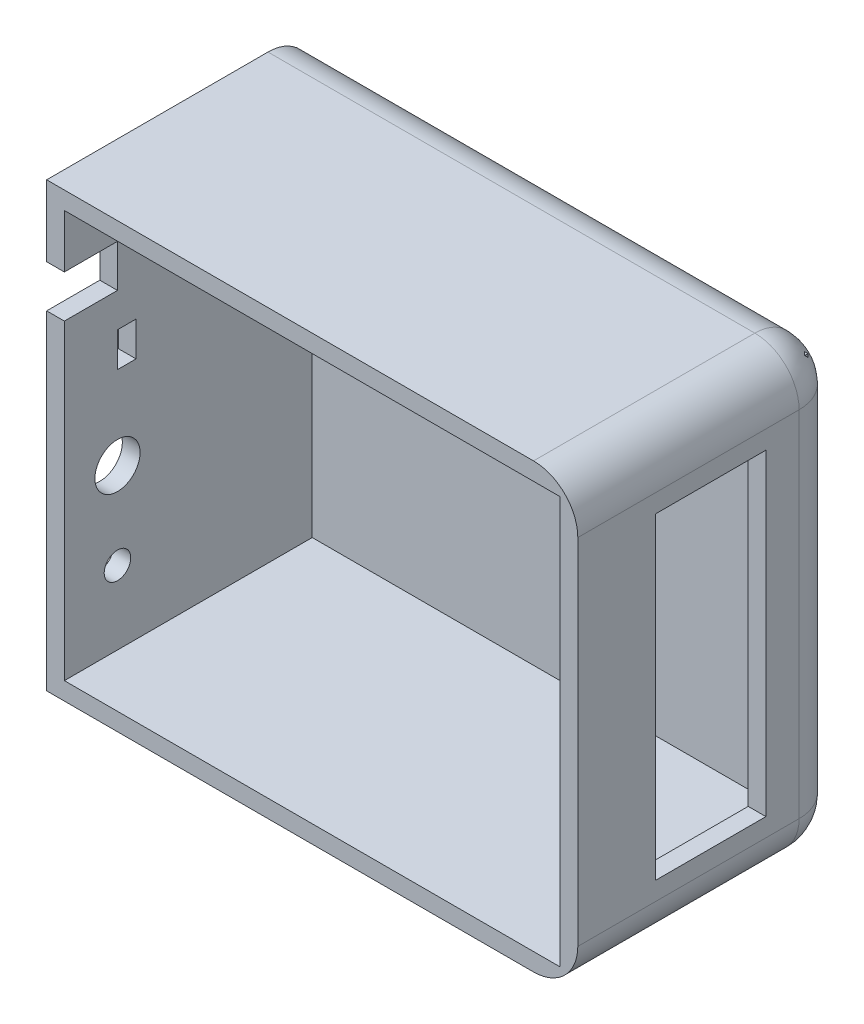
from build123d import *

# Parameters (mm, degrees)
ESBO_O1_W                  = 120
ESBO_O1_H                  = 100
RESSALTO_EXTRUS_O1_DEPTH   = 4
ESBO_O2_W                  = 4
ESBO_O2_H                  = 4
ESBO_O2_W_2                = 112
ESBO_O2_H_2                = 92
RESSALTO_EXTRUS_O2_DEPTH   = 60
CORTE_EXTRUS_O1_DEPTH      = 26
CORTE_EXTRUS_O1_DEPTH_BACK = 23
FILETE1_R                  = 10
FILETE2_R                  = 10
FILETE3_R                  = 10
CORTE_EXTRUS_O2_DEPTH      = 37
CORTE_EXTRUS_O2_DEPTH_BACK = 36
CORTE_EXTRUS_O3_DEPTH      = 28
CORTE_EXTRUS_O3_DEPTH_BACK = 18
F_3DSKETCH3_R              = 5.1
F_3DSKETCH3_R_2            = 3


with BuildPart() as part:
    # Esboço1 → Ressalto-extrusão1 (new body)
    with BuildSketch(Plane.XY):
        with Locations((60, 50)):
            Rectangle(ESBO_O1_W, ESBO_O1_H)
    extrude(amount=RESSALTO_EXTRUS_O1_DEPTH)

    # Esboço2 → Ressalto-extrusão2 (add)
    with BuildSketch(Plane.XY):
        with Locations((2, 98)):
            Rectangle(ESBO_O2_W, ESBO_O2_H)
        with Locations((118, 98)):
            Rectangle(ESBO_O2_W, ESBO_O2_H)
        with Locations((60, 98)):
            Rectangle(ESBO_O2_W_2, ESBO_O2_H)
        with Locations((118, 50)):
            Rectangle(ESBO_O2_W, ESBO_O2_H_2)
        with Locations((118, 2)):
            Rectangle(ESBO_O2_W, ESBO_O2_H)
        with Locations((60, 2)):
            Rectangle(ESBO_O2_W_2, ESBO_O2_H)
        with Locations((2, 2)):
            Rectangle(ESBO_O2_W, ESBO_O2_H)
        with Locations((2, 50)):
            Rectangle(ESBO_O2_W, ESBO_O2_H_2)
    extrude(amount=RESSALTO_EXTRUS_O2_DEPTH)

    # 3DSketch1 → Corte-extrusão1 (cut, two sides: drawn at the far end of the back side and taken through both)
    with BuildSketch(Plane(origin=(120, 14.15, 17.5), x_dir=(0, 0.9442477948596217, 0.32923563279624185), z_dir=(1, 0, 0)).offset(-CORTE_EXTRUS_O1_DEPTH_BACK)):
        Polygon((0, 0), (8.23089082, 23.606194871), (75.933457711, 0), (67.702566891, -23.606194871), align=None)
    extrude(amount=CORTE_EXTRUS_O1_DEPTH + CORTE_EXTRUS_O1_DEPTH_BACK, mode=Mode.SUBTRACT)

    # Filete1
    filete1_edges = [part.edges().sort_by_distance(p)[0] for p in [
        (120, 50, 0),
    ]]
    fillet(filete1_edges, radius=FILETE1_R)

    # Filete2
    filete2_edges = [part.edges().sort_by_distance(p)[0] for p in [
        (55, 0, 0),
        (120, 0, 35),
        (117.071067812, 0, 2.928932188),
    ]]
    fillet(filete2_edges, radius=FILETE2_R)

    # Filete3
    filete3_edges = [part.edges().sort_by_distance(p)[0] for p in [
        (120, 100, 35),
        (55, 100, 0),
        (117.071067812, 100, 2.928932188),
    ]]
    fillet(filete3_edges, radius=FILETE3_R)

    # 3DSketch2 → Corte-extrusão2 (cut, two sides: drawn at the far end of the back side and taken through both)
    with BuildSketch(Plane(origin=(0, 83.957923226, 60), x_dir=(0, -0.8401982536854657, -0.5422793509842448), z_dir=(1, 0, 0)).offset(-CORTE_EXTRUS_O2_DEPTH_BACK)):
        Polygon((0, 0), (6.507352212, 10.082379044), (14.573255447, 4.876497275), (8.065903235, -5.205881769), align=None)
        Polygon((21.042782001, 0.700946272), (23.320355275, 4.229778938), (29.873901653, 0), (27.596328379, -3.528832665), align=None)
    extrude(amount=CORTE_EXTRUS_O2_DEPTH + CORTE_EXTRUS_O2_DEPTH_BACK, mode=Mode.SUBTRACT)

    # 3DSketch3 → Corte-extrusão3 (cut, two sides: drawn at the far end of the back side and taken through both)
    with BuildSketch(Plane(origin=(0, 40.094193259, 48), x_dir=(0, -1, 0), z_dir=(-1, 0, 0)).offset(-CORTE_EXTRUS_O3_DEPTH_BACK)):
        with Locations(Location((0, 0, 0), (0, 0, 180))):
            Circle(F_3DSKETCH3_R)
        with Locations(Location((19.533873925, 0, 0), (0, 0, 180))):
            Circle(F_3DSKETCH3_R_2)
    extrude(amount=CORTE_EXTRUS_O3_DEPTH + CORTE_EXTRUS_O3_DEPTH_BACK, mode=Mode.SUBTRACT)


solid = part.part
